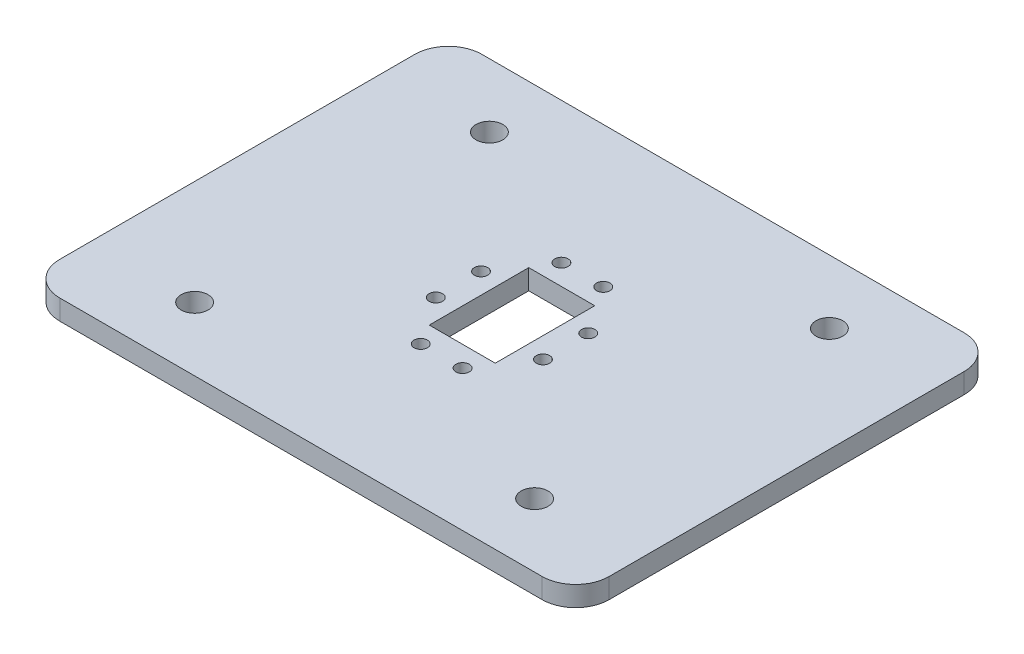
from build123d import *

# Parameters (mm, degrees)
SKETCH1_W           = 164
SKETCH1_H           = 126
SKETCH1_R           = 4
BOSS_EXTRUDE1_DEPTH = 6
FILLET1_R           = 10
SKETCH2_R           = 2
SKETCH2_W           = 19.7
SKETCH2_H           = 29.7
CUT_EXTRUDE1_DEPTH  = 207.900942482


with BuildPart() as part:
    # Sketch1 → Boss-Extrude1 (new body)
    with BuildSketch(Plane(origin=(0, 0, 0), x_dir=(1, 0, 0), z_dir=(0, 1, 0))):
        with Locations((-82, 63)):
            Rectangle(SKETCH1_W, SKETCH1_H)
        with Locations(Location((-132.75, 107, 0), (0, 0, 270))):
            Circle(SKETCH1_R, mode=Mode.SUBTRACT)
        with Locations(Location((-31.25, 107, 0), (0, 0, 270))):
            Circle(SKETCH1_R, mode=Mode.SUBTRACT)
        with Locations(Location((-132.75, 19, 0), (0, 0, 270))):
            Circle(SKETCH1_R, mode=Mode.SUBTRACT)
        with Locations(Location((-31.25, 19, 0), (0, 0, 270))):
            Circle(SKETCH1_R, mode=Mode.SUBTRACT)
    extrude(amount=BOSS_EXTRUDE1_DEPTH)

    # Fillet1
    fillet1_edges = [part.edges().sort_by_distance(p)[0] for p in [
        (0, 3, 0),
        (-164, 3, 0),
        (-164, 3, -126),
        (0, 3, -126),
    ]]
    fillet(fillet1_edges, radius=FILLET1_R)

    # Sketch2 → Cut-Extrude1 (cut, through all)
    with BuildSketch(Plane(origin=(0, 6, 0), x_dir=(1, 0, 0), z_dir=(0, 1, 0))):
        with Locations(Location((-88.25, 84, 0), (0, 0, 270))):
            Circle(SKETCH2_R)
        with Locations(Location((-75.75, 84, 0), (0, 0, 270))):
            Circle(SKETCH2_R)
        with Locations(Location((-98, 69.75, 0), (0, 0, 270))):
            Circle(SKETCH2_R)
        with Locations(Location((-98, 56.25, 0), (0, 0, 270))):
            Circle(SKETCH2_R)
        with Locations(Location((-88.25, 42, 0), (0, 0, 270))):
            Circle(SKETCH2_R)
        with Locations(Location((-75.75, 42, 0), (0, 0, 270))):
            Circle(SKETCH2_R)
        with Locations(Location((-66, 56.25, 0), (0, 0, 270))):
            Circle(SKETCH2_R)
        with Locations(Location((-66, 69.75, 0), (0, 0, 270))):
            Circle(SKETCH2_R)
        with Locations((-82, 63)):
            Rectangle(SKETCH2_W, SKETCH2_H)
    extrude(amount=-CUT_EXTRUDE1_DEPTH, mode=Mode.SUBTRACT)


solid = part.part
